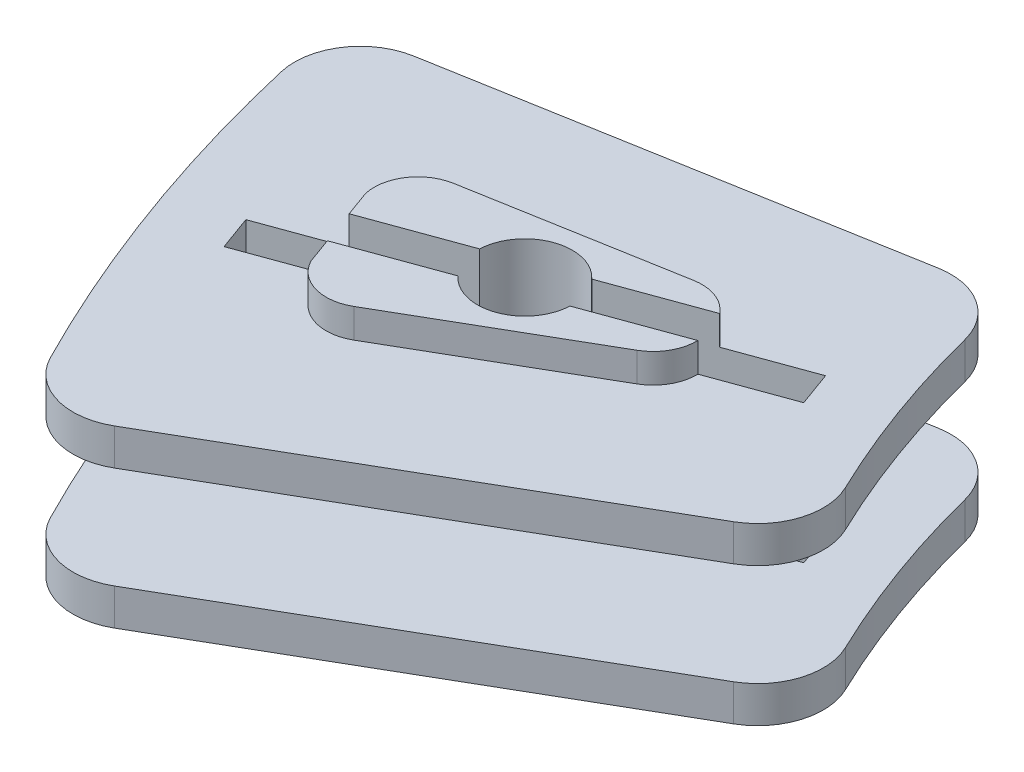
from build123d import *

# Parameters (mm, degrees)
BOSS_EXTRUDE1_DEPTH = 2.5
BOSS_EXTRUDE2_DEPTH = 7
CUT_EXTRUDE1_DEPTH  = 120.106847206
BOSS_EXTRUDE3_START = 2
BOSS_EXTRUDE3_DEPTH = 2


with BuildPart() as part:
    # Sketch1 → Boss-Extrude1 (new body)
    with BuildSketch(Plane(origin=(0, 0, 0), x_dir=(1, 0, 0), z_dir=(0, 1, 0))):
        with BuildLine():
            Line((-72.307015928, -13.524843261), (-102.896359968, -18.918569937))
            ThreePointArc((-102.896359968, -18.918569937), (-105.867796955, -20.867043845), (-106.499308602, -24.363782522))
            ThreePointArc((-106.499308602, -24.363782522), (-102.726730434, -37.092873959), (-97.434590717, -49.268890224))
            ThreePointArc((-97.434590717, -49.268890224), (-94.703164434, -51.541619594), (-91.174456756, -51.124234325))
            Line((-91.174456756, -51.124234325), (-64.274639058, -35.593617336))
            ThreePointArc((-64.274639058, -35.593617336), (-62.224627836, -33.023116562), (-62.470083693, -29.74443212))
            ThreePointArc((-62.470083693, -29.74443212), (-65.139025602, -23.412068226), (-67.164862535, -16.845633263))
            ThreePointArc((-67.164862535, -16.845633263), (-69.084330175, -14.176239282), (-72.307015928, -13.524843261))
        make_face()
    boss_extrude1 = extrude(amount=BOSS_EXTRUDE1_DEPTH)

    # Sketch2 → Boss-Extrude2 (add)
    with BuildSketch(Plane(origin=(0, 2.5, 0), x_dir=(1, 0, 0), z_dir=(0, 1, 0))):
        with BuildLine():
            Line((-75.996588964, -24.219866543), (-90.54428362, -26.785017618))
            ThreePointArc((-90.54428362, -26.785017618), (-94.837750272, -34.221520002), (-86.76867241, -37.158424161))
            Line((-86.76867241, -37.158424161), (-73.975644431, -29.772366014))
            ThreePointArc((-73.975644431, -29.772366014), (-72.656566568, -26.148229372), (-75.996588964, -24.219866543))
        make_face()
    extrude(amount=BOSS_EXTRUDE2_DEPTH)

    # Mirror1: Boss-Extrude1 across plane
    add(boss_extrude1.mirror(Plane.ZX.offset(6)))

    # Sketch4 → Cut-Extrude1 (cut, through all)
    with BuildSketch(Plane(origin=(0, 12, 0), x_dir=(1, 0, 0), z_dir=(0, 1, 0))):
        with BuildLine():
            Line((-98.925638819, -34.379167538), (-87.179481059, -30.103915746))
            ThreePointArc((-87.179481059, -30.103915746), (-85.044443484, -27.198470075), (-81.541325335, -28.051794886))
            Line((-81.541325335, -28.051794886), (-69.795167575, -23.776543095))
            Line((-69.795167575, -23.776543095), (-68.940117216, -26.125774647))
            Line((-68.940117216, -26.125774647), (-80.686274976, -30.401026438))
            ThreePointArc((-80.686274976, -30.401026438), (-82.821312552, -33.30647211), (-86.324430701, -32.453147298))
            Line((-86.324430701, -32.453147298), (-98.070588461, -36.72839909))
            Line((-98.070588461, -36.72839909), (-98.925638819, -34.379167538))
        make_face()
    extrude(amount=-CUT_EXTRUDE1_DEPTH, mode=Mode.SUBTRACT)

    # Sketch5 → Boss-Extrude3 (add)
    with BuildSketch(Plane(origin=(0, 12, 0), x_dir=(1, 0, 0), z_dir=(0, 1, 0)).offset(BOSS_EXTRUDE3_START)):
        with BuildLine():
            Line((-88.070170969, -37.828843014), (-75.758777587, -30.720856731))
            ThreePointArc((-75.758777587, -30.720856731), (-74.645598026, -29.596311171), (-74.25939673, -28.061834057))
            Line((-74.25939673, -28.061834057), (-80.686274976, -30.401026438))
            ThreePointArc((-80.686274976, -30.401026438), (-82.821312552, -33.30647211), (-86.324430701, -32.453147298))
            Line((-86.324430701, -32.453147298), (-92.880168291, -34.839240645))
            Line((-92.880168291, -34.839240645), (-92.238880522, -36.601164309))
            ThreePointArc((-92.238880522, -36.601164309), (-90.417678642, -38.108566439), (-88.070170969, -37.828843014))
        make_face()
        with BuildLine():
            Line((-77.97222629, -24.6394564), (-91.97222629, -27.108034129))
            ThreePointArc((-91.97222629, -27.108034129), (-93.95032425, -28.4027024), (-94.376506418, -30.728085429))
            Line((-94.376506418, -30.728085429), (-93.735218649, -32.490009093))
            Line((-93.735218649, -32.490009093), (-87.179481059, -30.103915746))
            ThreePointArc((-87.179481059, -30.103915746), (-85.044443484, -27.198470075), (-81.541325335, -28.051794886))
            Line((-81.541325335, -28.051794886), (-75.114447088, -25.712602505))
            ThreePointArc((-75.114447088, -25.712602505), (-76.396637321, -24.785370248), (-77.97222629, -24.6394564))
        make_face()
    extrude(amount=-BOSS_EXTRUDE3_DEPTH)


solid = part.part
